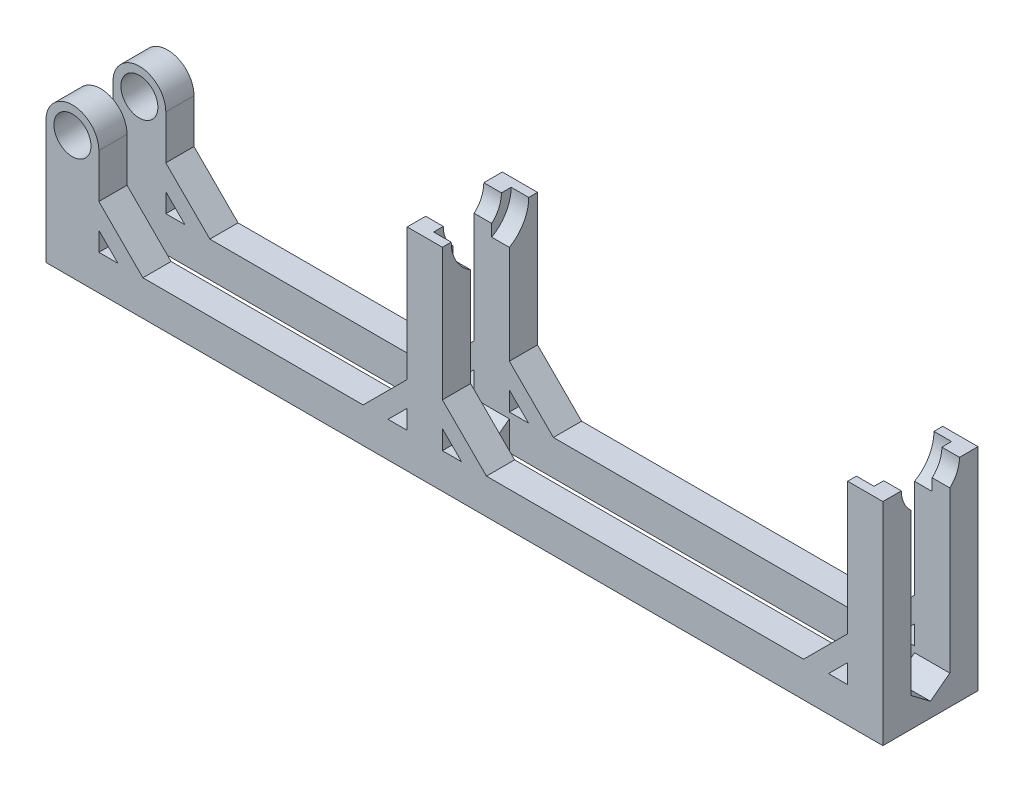
from build123d import *

# Parameters (mm, degrees)
SKETCH1_R               = 5.25
BOSS_EXTRUDE1_DEPTH     = 8
BOSS_EXTRUDE2_DEPTH     = 10
LPATTERN1_COUNT         = 2
LPATTERN1_PITCH         = 125
MIRROR1_COPY_1_DEPTH    = 10
CUT_EXTRUDE1_START      = -5
SKETCH3_R               = 11
CUT_EXTRUDE1_DEPTH      = 125
CUT_EXTRUDE2_DEPTH      = 10
CUT_EXTRUDE2_DEPTH_BACK = 149.949655924
SKETCH4_R               = 8.25


with BuildPart() as part:
    # Sketch1 → Boss-Extrude1 (new body)
    with BuildSketch(Plane.XY):
        with BuildLine():
            Line((230, 0), (230, 60))
            Line((230, 60), (220, 60))
            Line((220, 60), (220, 22.5))
            Line((220, 22.5), (207.5, 10))
            Line((207.5, 10), (117.5, 10))
            Line((117.5, 10), (105, 22.5))
            Line((105, 22.5), (105, 60))
            Line((105, 60), (95, 60))
            Line((95, 60), (95, 22.5))
            Line((95, 22.5), (82.5, 10))
            Line((82.5, 10), (20, 10))
            Line((20, 10), (7.5, 22.5))
            Line((7.5, 22.5), (7.5, 35))
            ThreePointArc((7.5, 35), (0, 42.5), (-7.5, 35))
            Line((-7.5, 35), (-7.5, 0))
            Line((-7.5, 0), (230, 0))
        make_face()
        Polygon((95, 15.428932188), (95, 10), (89.571067812, 10), align=None, mode=Mode.SUBTRACT)
        Polygon((110.428932188, 10), (105, 10), (105, 15.428932188), align=None, mode=Mode.SUBTRACT)
        Polygon((220, 15.428932188), (220, 10), (214.571067812, 10), align=None, mode=Mode.SUBTRACT)
        with Locations((0, 35)):
            Circle(SKETCH1_R, mode=Mode.SUBTRACT)
        Polygon((7.5, 15.428932188), (12.928932188, 10), (7.5, 10), align=None, mode=Mode.SUBTRACT)
    boss_extrude1 = extrude(amount=BOSS_EXTRUDE1_DEPTH)

    # Sketch2 → Boss-Extrude2 (add)
    with BuildSketch(Plane(origin=(95, 0, 0), x_dir=(0, 0, -1), z_dir=(1, 0, 0))):
        Polygon((5.5, 4.166666667), (0, 8.333333333), (0, 0), (5.5, 0), align=None)
    boss_extrude2 = extrude(amount=BOSS_EXTRUDE2_DEPTH)

    # LPattern1: Boss-Extrude2 ×2
    with Locations(*[(i * LPATTERN1_PITCH, 0, 0) for i in range(1, LPATTERN1_COUNT)]):
        add(boss_extrude2)

    # Mirror1: Boss-Extrude1, Boss-Extrude2 across plane
    add(boss_extrude1.mirror(Plane(origin=(105, 0, -5.5), x_dir=(1, 0, 0), z_dir=(0, 0, 1))))
    add(boss_extrude2.mirror(Plane(origin=(105, 0, -5.5), x_dir=(1, 0, 0), z_dir=(0, 0, 1))))

    # Mirror1 copy 1 sketch → Mirror1 copy 1 (add)
    with BuildSketch(Plane(origin=(220, 0, -11), x_dir=(0, 0, 1), z_dir=(1, 0, 0))):
        Polygon((5.5, -4.166666667), (0, -8.333333333), (0, 0), (5.5, 0), align=None)
    extrude(amount=MIRROR1_COPY_1_DEPTH)

    # Sketch3 → Cut-Extrude1 (cut)
    with BuildSketch(Plane(origin=(105, 0, 0), x_dir=(0, 0, -1), z_dir=(1, 0, 0)).offset(CUT_EXTRUDE1_START)):
        with Locations((5.5, 60)):
            Circle(SKETCH3_R)
    extrude(amount=CUT_EXTRUDE1_DEPTH, mode=Mode.SUBTRACT)

    # Sketch4 → Cut-Extrude2 (cut, two sides: drawn at the far end of the back side and taken through both)
    with BuildSketch(Plane.ZY.offset(-95).offset(-CUT_EXTRUDE2_DEPTH_BACK)):
        with Locations((-5.5, 60)):
            Circle(SKETCH4_R)
    extrude(amount=CUT_EXTRUDE2_DEPTH + CUT_EXTRUDE2_DEPTH_BACK, mode=Mode.SUBTRACT)


solid = part.part
